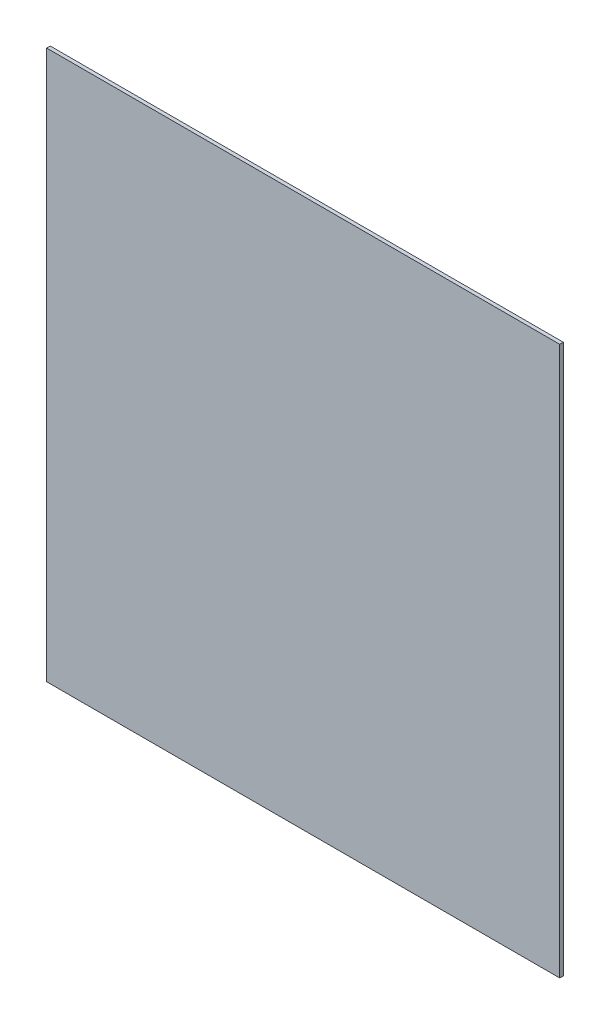
from build123d import *

# Parameters (mm, degrees)
SKETCH1_W           = 430
SKETCH1_H           = 460
BOSS_EXTRUDE1_DEPTH = 3


with BuildPart() as part:
    # Sketch1 → Boss-Extrude1 (new body)
    with BuildSketch(Plane.XY):
        Rectangle(SKETCH1_W, SKETCH1_H)
    extrude(amount=BOSS_EXTRUDE1_DEPTH)


solid = part.part
